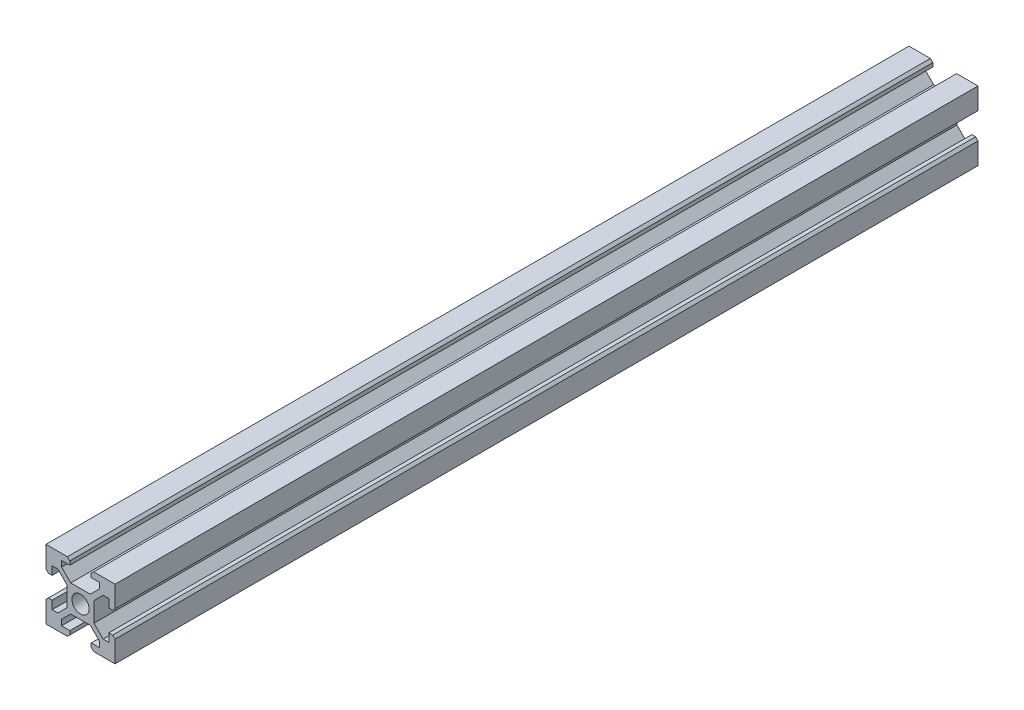
from build123d import *

# Parameters (mm, degrees)
SKETCH1_R           = 2.5
BOSS_EXTRUDE1_DEPTH = 125


with BuildPart() as part:
    # Sketch1 → Boss-Extrude1 (new, symmetric)
    with BuildSketch(Plane.XY):
        Polygon((3.9, -2.839339828), (6.560660172, -5.5), (8.200660172, -5.5), (8.200660172, -3.1), (9.3, -3.1), (10, -3.8), (10, -10), (3.8, -10), (3.1, -9.3), (3.1, -8.200660172), (5.5, -8.200660172), (5.5, -6.560660172), (2.839339828, -3.9), (-2.839339828, -3.9), (-5.5, -6.560660172), (-5.5, -8.200660172), (-3.1, -8.200660172), (-3.1, -9.3), (-3.8, -10), (-10, -10), (-10, -3.8), (-9.3, -3.1), (-8.200660172, -3.1), (-8.200660172, -5.5), (-6.560660172, -5.5), (-3.9, -2.839339828), (-3.9, 2.839339828), (-6.560660172, 5.5), (-8.200660172, 5.5), (-8.200660172, 3.1), (-9.3, 3.1), (-10, 3.8), (-10, 10), (-3.8, 10), (-3.1, 9.3), (-3.1, 8.200660172), (-5.5, 8.200660172), (-5.5, 6.560660172), (-2.839339828, 3.9), (2.839339828, 3.9), (5.5, 6.560660172), (5.5, 8.200660172), (3.1, 8.200660172), (3.1, 9.3), (3.8, 10), (10, 10), (10, 3.8), (9.3, 3.1), (8.200660172, 3.1), (8.200660172, 5.5), (6.560660172, 5.5), (3.9, 2.839339828), align=None)
        Circle(SKETCH1_R, mode=Mode.SUBTRACT)
    extrude(amount=BOSS_EXTRUDE1_DEPTH, both=True)


solid = part.part
